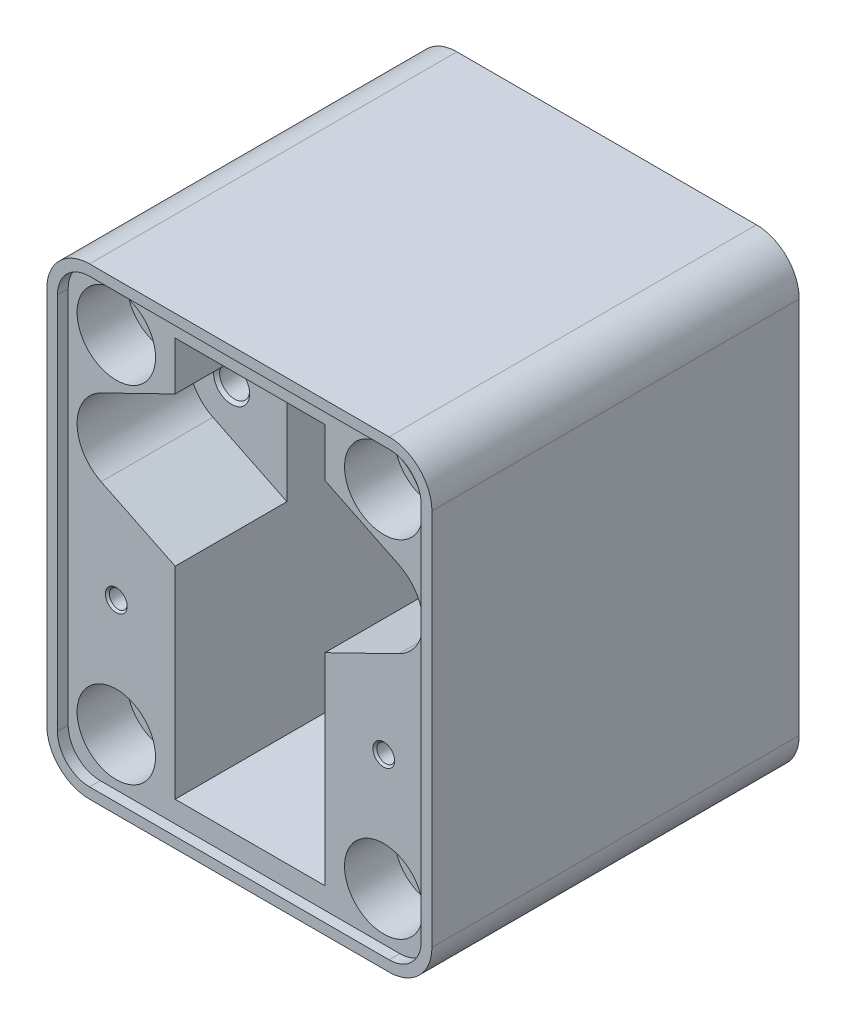
from build123d import *

# Parameters (mm, degrees)
SKETCH1_W                   = 54
SKETCH1_H                   = 65
BOSS_EXTRUDE1_DEPTH         = 50
SKETCH2_W                   = 21
SKETCH2_H                   = 41.5
CUT_EXTRUDE1_DEPTH          = 99.188594042
FILLET1_R                   = 6
SKETCH3_W                   = 21
SKETCH3_H                   = 56
CUT_EXTRUDE2_DEPTH          = 42
CUT_EXTRUDE_THIN3_DEPTH     = 15.67
CUT_EXTRUDE3_DEPTH          = 15.67
M5_TAPPED_HOLE1_D           = 4.2
M5_TAPPED_HOLE1_DEPTH       = 15
M5_TAPPED_HOLE1_CSINK_D     = 5.05
M5_TAPPED_HOLE1_CSINK_ANGLE = 90
M5_TAPPED_HOLE1_TIP         = 1.2618073
M3_TAPPED_HOLE1_D           = 2.5
M3_TAPPED_HOLE1_CSINK_D     = 3.05
M3_TAPPED_HOLE1_CSINK_ANGLE = 90
HOLE1_D                     = 6.5
HOLE1_CBORE_D               = 11
HOLE1_CBORE_DEPTH           = 7
EXTRUDE_THIN1_START         = 1.5
EXTRUDE_THIN1_DEPTH         = 1.5
M3_TAPPED_HOLE2_D           = 2.5
M3_TAPPED_HOLE2_CSINK_D     = 3.05
M3_TAPPED_HOLE2_CSINK_ANGLE = 90


with BuildPart() as part:
    # Sketch1 → Boss-Extrude1 (new body)
    with BuildSketch(Plane.XY):
        with Locations((27, 32.5)):
            Rectangle(SKETCH1_W, SKETCH1_H)
    extrude(amount=BOSS_EXTRUDE1_DEPTH)

    # Sketch2 → Cut-Extrude1 (cut, through all)
    with BuildSketch(Plane.XY.offset(50)):
        with Locations((27, 32.5)):
            Rectangle(SKETCH2_W, SKETCH2_H)
    extrude(amount=-CUT_EXTRUDE1_DEPTH, mode=Mode.SUBTRACT)

    # Fillet1
    fillet1_edges = [part.edges().sort_by_distance(p)[0] for p in [
        (0, 65, 25),
        (0, 0, 25),
        (54, 65, 25),
        (54, 0, 25),
    ]]
    fillet(fillet1_edges, radius=FILLET1_R)

    # Sketch3 → Cut-Extrude2 (cut)
    with BuildSketch(Plane.XY.offset(50)):
        with Locations((27, 32.5)):
            Rectangle(SKETCH3_W, SKETCH3_H)
    extrude(amount=-CUT_EXTRUDE2_DEPTH, mode=Mode.SUBTRACT)

    # Sketch4 → Cut-Extrude-Thin3 (cut)
    with BuildSketch(Plane.XY.offset(50)):
        with BuildLine():
            Line((6.119863014, 48.642808121), (20.863013699, 55.83321895))
            ThreePointArc((20.863013699, 55.83321895), (27, 57.25), (33.136986301, 55.83321895))
            Line((33.136986301, 55.83321895), (47.880136986, 48.642808121))
            ThreePointArc((47.880136986, 48.642808121), (51.25, 43.25), (47.880136986, 37.857191879))
            Line((47.880136986, 37.857191879), (33.136986301, 30.66678105))
            ThreePointArc((33.136986301, 30.66678105), (27, 29.25), (20.863013699, 30.66678105))
            Line((20.863013699, 30.66678105), (6.119863014, 37.857191879))
            ThreePointArc((6.119863014, 37.857191879), (2.75, 43.25), (6.119863014, 48.642808121))
        make_face()
        with BuildLine():
            Line((6.339041096, 48.193407445), (21.082191781, 55.383818273))
            ThreePointArc((21.082191781, 55.383818273), (27, 56.75), (32.917808219, 55.383818273))
            Line((32.917808219, 55.383818273), (47.660958904, 48.193407445))
            ThreePointArc((47.660958904, 48.193407445), (50.75, 43.25), (47.660958904, 38.306592555))
            Line((47.660958904, 38.306592555), (32.917808219, 31.116181727))
            ThreePointArc((32.917808219, 31.116181727), (27, 29.75), (21.082191781, 31.116181727))
            Line((21.082191781, 31.116181727), (6.339041096, 38.306592555))
            ThreePointArc((6.339041096, 38.306592555), (3.25, 43.25), (6.339041096, 48.193407445))
        make_face(mode=Mode.SUBTRACT)
    extrude(amount=-CUT_EXTRUDE_THIN3_DEPTH, mode=Mode.SUBTRACT)

    # Sketch4<3> → Cut-Extrude3 (cut)
    with BuildSketch(Plane.XY.offset(50)):
        with BuildLine():
            Line((32.917808219, 55.383818273), (47.660958904, 48.193407445))
            ThreePointArc((47.660958904, 48.193407445), (50.75, 43.25), (47.660958904, 38.306592555))
            Line((47.660958904, 38.306592555), (32.917808219, 31.116181727))
            ThreePointArc((32.917808219, 31.116181727), (27, 29.75), (21.082191781, 31.116181727))
            Line((21.082191781, 31.116181727), (6.339041096, 38.306592555))
            ThreePointArc((6.339041096, 38.306592555), (3.25, 43.25), (6.339041096, 48.193407445))
            Line((6.339041096, 48.193407445), (21.082191781, 55.383818273))
            ThreePointArc((21.082191781, 55.383818273), (27, 56.75), (32.917808219, 55.383818273))
        make_face()
    extrude(amount=-CUT_EXTRUDE3_DEPTH, mode=Mode.SUBTRACT)

    # M5 Tapped Hole1
    with Locations(Plane(origin=(8.75, 43.25, 34.33), x_dir=(1, 0, 0), z_dir=(0, 0, 1))):
        with Locations((0, 0), (36.5, 0)):
            CounterSinkHole(M5_TAPPED_HOLE1_D / 2, M5_TAPPED_HOLE1_CSINK_D / 2, depth=M5_TAPPED_HOLE1_DEPTH, counter_sink_angle=M5_TAPPED_HOLE1_CSINK_ANGLE)
            with Locations((0, 0, -(M5_TAPPED_HOLE1_DEPTH + M5_TAPPED_HOLE1_TIP / 2))):  # 118° drill point
                Cone(0, M5_TAPPED_HOLE1_D / 2, M5_TAPPED_HOLE1_TIP, mode=Mode.SUBTRACT)

    # M3 Tapped Hole1 (through all)
    with Locations(Plane(origin=(22, 56.85, 8), x_dir=(1, 0, 0), z_dir=(0, 0, 1))):
        with Locations((0, 0), (10, 0), (10, -48.7), (0, -48.7)):
            CounterSinkHole(M3_TAPPED_HOLE1_D / 2, M3_TAPPED_HOLE1_CSINK_D / 2, counter_sink_angle=M3_TAPPED_HOLE1_CSINK_ANGLE)

    # Hole1 (through all)
    with Locations(Plane(origin=(8.25, 56.75, 50), x_dir=(1, 0, 0), z_dir=(0, 0, 1))):
        with Locations((0, 0), (37.5, 0), (37.5, -48.5), (0, -48.5)):
            CounterBoreHole(HOLE1_D / 2, HOLE1_CBORE_D / 2, HOLE1_CBORE_DEPTH)

    # Sketch10 → Extrude-Thin1 (add)
    with BuildSketch(Plane.XY.offset(50).offset(EXTRUDE_THIN1_START)):
        with BuildLine():
            Line((48, 65), (6, 65))
            ThreePointArc((6, 65), (1.757359313, 63.242640687), (0, 59))
            Line((0, 59), (0, 6))
            ThreePointArc((0, 6), (1.757359313, 1.757359313), (6, 0))
            Line((6, 0), (48, 0))
            ThreePointArc((48, 0), (52.242640687, 1.757359313), (54, 6))
            Line((54, 6), (54, 59))
            ThreePointArc((54, 59), (52.242640687, 63.242640687), (48, 65))
        make_face()
        with BuildLine():
            Line((48, 63.5), (6, 63.5))
            ThreePointArc((6, 63.5), (2.818019485, 62.181980515), (1.5, 59))
            Line((1.5, 59), (1.5, 6))
            ThreePointArc((1.5, 6), (2.818019485, 2.818019485), (6, 1.5))
            Line((6, 1.5), (48, 1.5))
            ThreePointArc((48, 1.5), (51.181980515, 2.818019485), (52.5, 6))
            Line((52.5, 6), (52.5, 59))
            ThreePointArc((52.5, 59), (51.181980515, 62.181980515), (48, 63.5))
        make_face(mode=Mode.SUBTRACT)
    extrude(amount=-EXTRUDE_THIN1_DEPTH)

    # M3 Tapped Hole2 (through all)
    with Locations(Plane(origin=(8.25, 24.550881691, 50), x_dir=(1, 0, 0), z_dir=(0, 0, 1))):
        with Locations((0, 0), (37.5, 0)):
            CounterSinkHole(M3_TAPPED_HOLE2_D / 2, M3_TAPPED_HOLE2_CSINK_D / 2, counter_sink_angle=M3_TAPPED_HOLE2_CSINK_ANGLE)


solid = part.part
